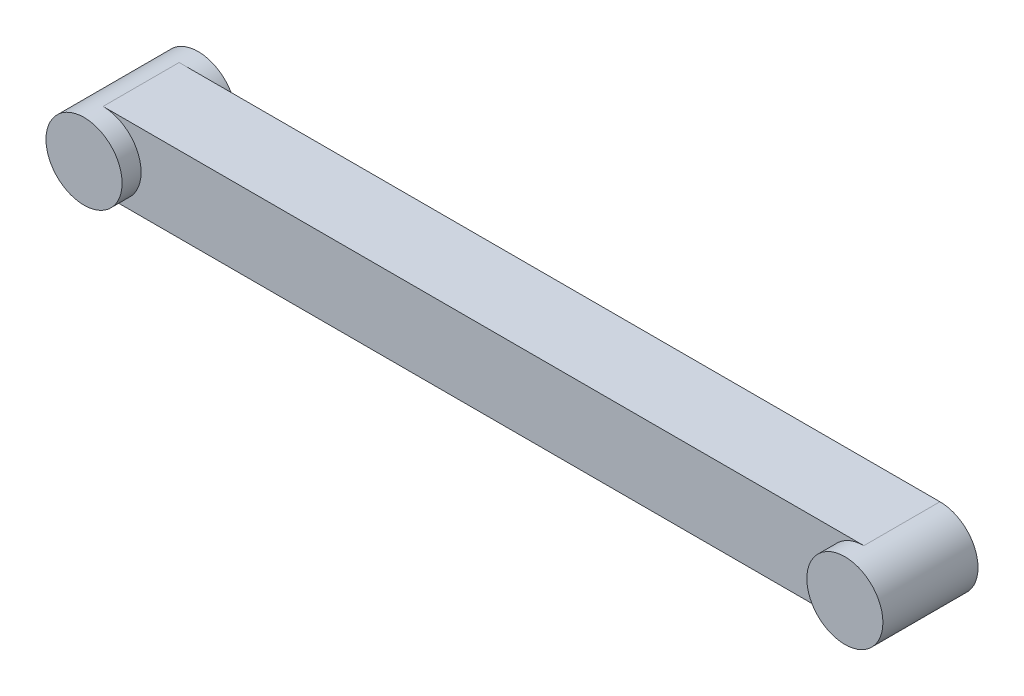
from build123d import *

# Parameters (mm, degrees)
BOSS_EXTRUDE1_DEPTH = 20
SKETCH2_R           = 10
BOSS_EXTRUDE2_DEPTH = 5
BOSS_EXTRUDE3_START = 5
SKETCH3_R           = 10
BOSS_EXTRUDE3_DEPTH = 5
SKETCH4_R           = 10
BOSS_EXTRUDE4_DEPTH = 5


with BuildPart() as part:
    # Sketch1 → Boss-Extrude1 (new body)
    with BuildSketch(Plane.XY):
        with BuildLine():
            Line((-46.135379716, 14.647544511), (153.864620284, 14.647544511))
            ThreePointArc((153.864620284, 14.647544511), (160.935688096, 11.718612322), (163.864620284, 4.647544511))
            ThreePointArc((163.864620284, 4.647544511), (160.935688096, -2.423523301), (153.864620284, -5.352455489))
            Line((153.864620284, -5.352455489), (-46.135379716, -5.352455489))
            ThreePointArc((-46.135379716, -5.352455489), (-53.206447528, -2.423523301), (-56.135379716, 4.647544511))
            ThreePointArc((-56.135379716, 4.647544511), (-53.206447528, 11.718612322), (-46.135379716, 14.647544511))
        make_face()
    extrude(amount=BOSS_EXTRUDE1_DEPTH)

    # Sketch2 → Boss-Extrude2 (add)
    with BuildSketch(Plane.XY.offset(20)):
        with Locations(Location((-46.135379716, 4.647544511, 0), (0, 0, 270))):
            Circle(SKETCH2_R)
    extrude(amount=BOSS_EXTRUDE2_DEPTH)

    # Sketch3 → Boss-Extrude3 (add)
    with BuildSketch(Plane(origin=(0, 0, 0), x_dir=(-1, 0, 0), z_dir=(0, 0, -1)).offset(BOSS_EXTRUDE3_START)):
        with Locations((46.135379716, 4.647544511)):
            Circle(SKETCH3_R)
    extrude(amount=-BOSS_EXTRUDE3_DEPTH)

    # Sketch4 → Boss-Extrude4 (add)
    with BuildSketch(Plane.XY.offset(20)):
        with Locations(Location((153.864620284, 4.647544511, 0), (0, 0, 90))):
            Circle(SKETCH4_R)
    extrude(amount=BOSS_EXTRUDE4_DEPTH)


solid = part.part
